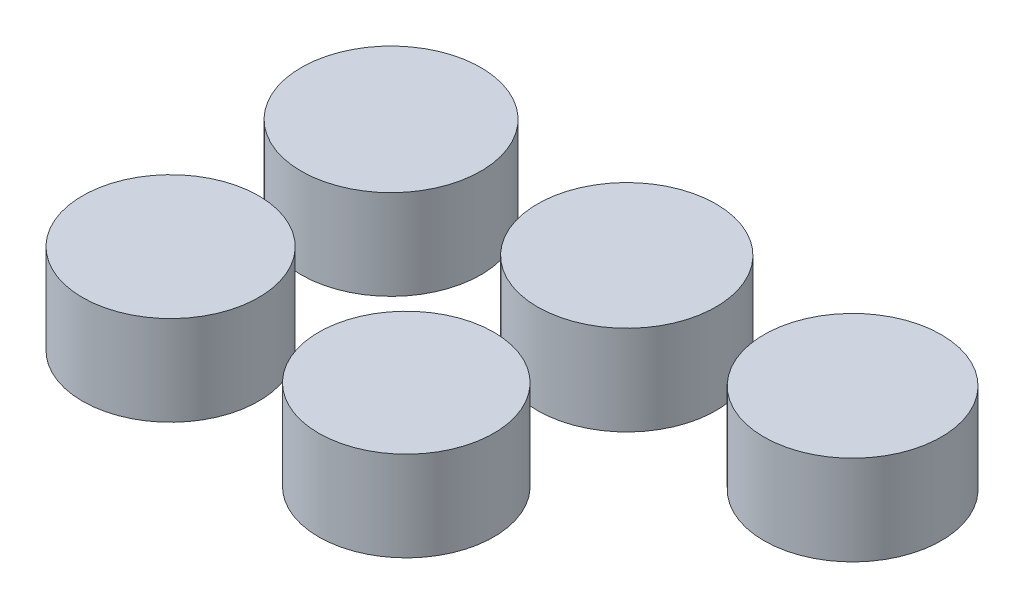
from build123d import *

# Parameters (mm, degrees)
SKETCH1_R             = 4
BOSS_EXTRUDE1_DEPTH   = 4
SKETCH1_R_2           = 3.975
BOSS_EXTRUDE1_2_DEPTH = 4
SKETCH1_R_3           = 3.95
BOSS_EXTRUDE1_3_DEPTH = 4
SKETCH1_R_4           = 3.925
BOSS_EXTRUDE1_4_DEPTH = 4
SKETCH1_R_5           = 3.9
BOSS_EXTRUDE1_5_DEPTH = 4


with BuildPart() as part:
    # Sketch1 → Boss-Extrude1 (new body)
    with BuildSketch(Plane(origin=(0, 0, 0), x_dir=(1, 0, 0), z_dir=(0, 1, 0))):
        with Locations(Location((0, 0, 0), (0, 0, 270))):
            Circle(SKETCH1_R)
    extrude(amount=BOSS_EXTRUDE1_DEPTH)


with BuildPart() as body_2:
    # Sketch1 → Boss-Extrude1 2 (new body)
    with BuildSketch(Plane(origin=(0, 0, 0), x_dir=(1, 0, 0), z_dir=(0, 1, 0))):
        with Locations(Location((10.4966154, 0, 0), (0, 0, 270))):
            Circle(SKETCH1_R_2)
    extrude(amount=BOSS_EXTRUDE1_2_DEPTH)


with BuildPart() as body_3:
    # Sketch1 → Boss-Extrude1 3 (new body)
    with BuildSketch(Plane(origin=(0, 0, 0), x_dir=(1, 0, 0), z_dir=(0, 1, 0))):
        with Locations(Location((20.55583574, 0, 0), (0, 0, 270))):
            Circle(SKETCH1_R_3)
    extrude(amount=BOSS_EXTRUDE1_3_DEPTH)


with BuildPart() as body_4:
    # Sketch1 → Boss-Extrude1 4 (new body)
    with BuildSketch(Plane(origin=(0, 0, 0), x_dir=(1, 0, 0), z_dir=(0, 1, 0))):
        with Locations(Location((0, -9.818892144, 0), (0, 0, 270))):
            Circle(SKETCH1_R_4)
    extrude(amount=BOSS_EXTRUDE1_4_DEPTH)


with BuildPart() as body_5:
    # Sketch1 → Boss-Extrude1 5 (new body)
    with BuildSketch(Plane(origin=(0, 0, 0), x_dir=(1, 0, 0), z_dir=(0, 1, 0))):
        with Locations(Location((10.4966154, -9.818892144, 0), (0, 0, 270))):
            Circle(SKETCH1_R_5)
    extrude(amount=BOSS_EXTRUDE1_5_DEPTH)


solid = Compound([part.part, body_2.part, body_3.part, body_4.part, body_5.part])
